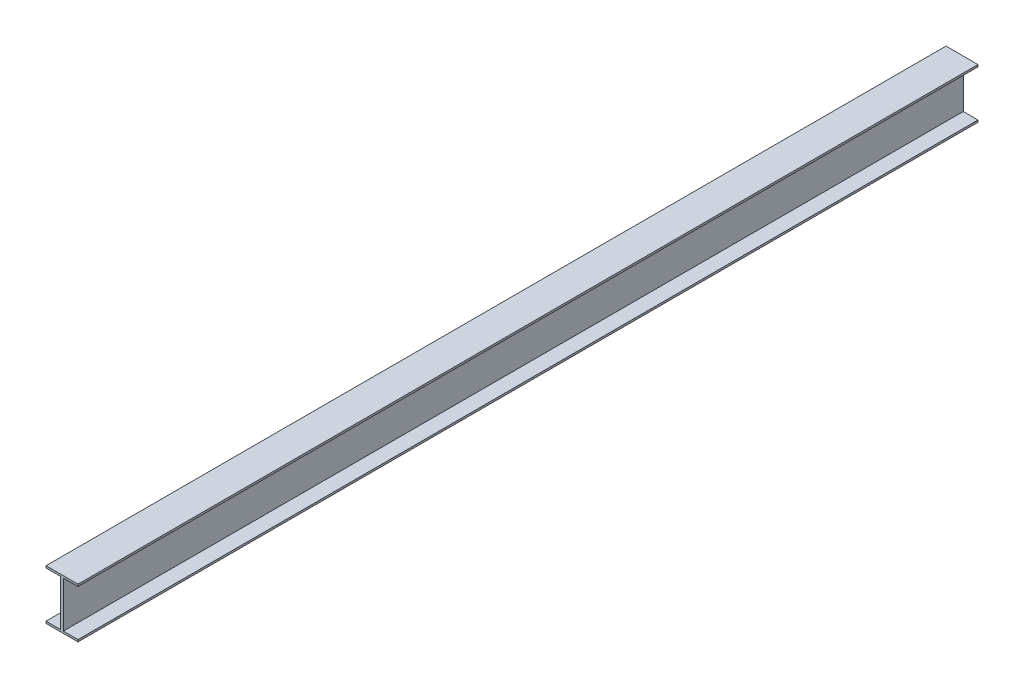
from build123d import *

# Parameters (mm, degrees)
SKETCH_2_W          = 160
SKETCH_2_H          = 250
EXTRUDE_1_DEPTH     = 4500
SKETCH_3_W          = 73.5
SKETCH_3_H          = 230
CUT_EXTRUDE_1_DEPTH = 4510.778265059


with BuildPart() as part:
    # 草图2 → 凸台-拉伸1 (new body)
    with BuildSketch(Plane.XY):
        with Locations((80, 125)):
            Rectangle(SKETCH_2_W, SKETCH_2_H)
    extrude(amount=EXTRUDE_1_DEPTH)

    # 草图3 → 切除-拉伸1 (cut, through all)
    with BuildSketch(Plane.XY.offset(4500)):
        with Locations((123.25, 125)):
            Rectangle(SKETCH_3_W, SKETCH_3_H)
        with Locations((36.75, 125)):
            Rectangle(SKETCH_3_W, SKETCH_3_H)
    extrude(amount=-CUT_EXTRUDE_1_DEPTH, mode=Mode.SUBTRACT)


solid = part.part
